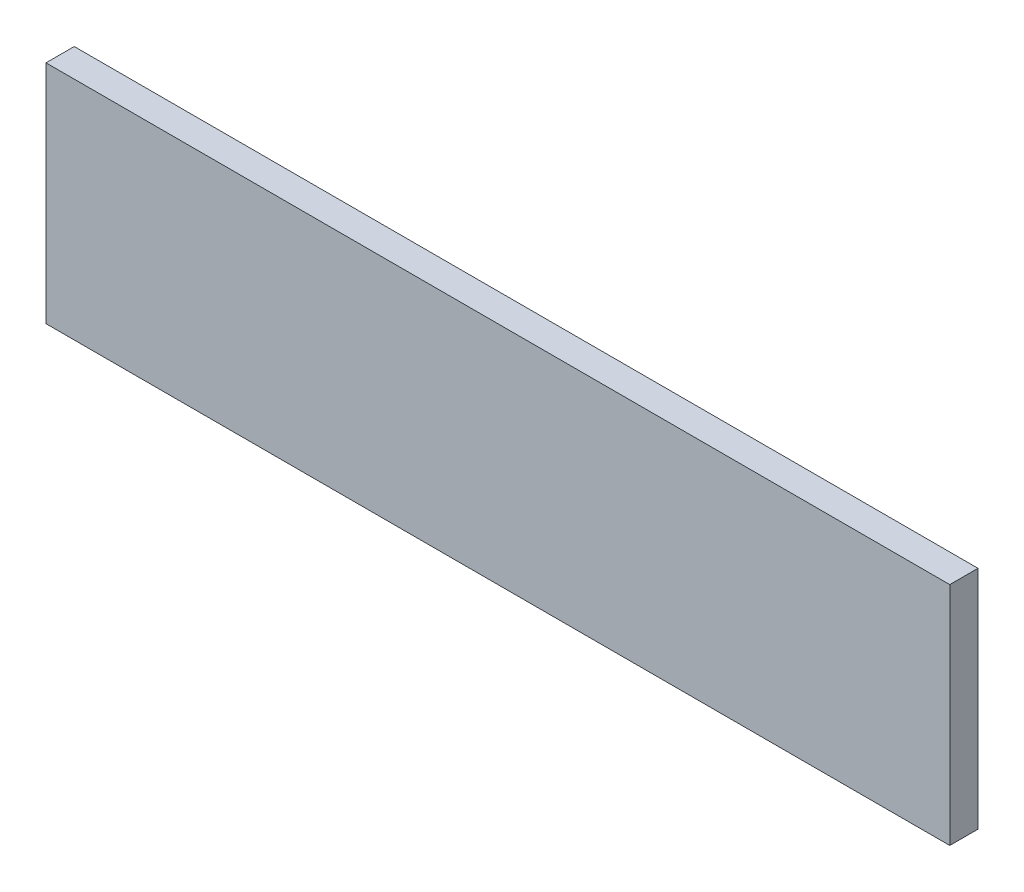
from build123d import *

# Parameters (mm, degrees)
SKETCH1_W           = 203.2
SKETCH1_H           = 50.8
BOSS_EXTRUDE1_DEPTH = 6.35


with BuildPart() as part:
    # Sketch1 → Boss-Extrude1 (new body)
    with BuildSketch(Plane.XY):
        with Locations((101.6, 25.4)):
            Rectangle(SKETCH1_W, SKETCH1_H)
    extrude(amount=BOSS_EXTRUDE1_DEPTH)


solid = part.part
